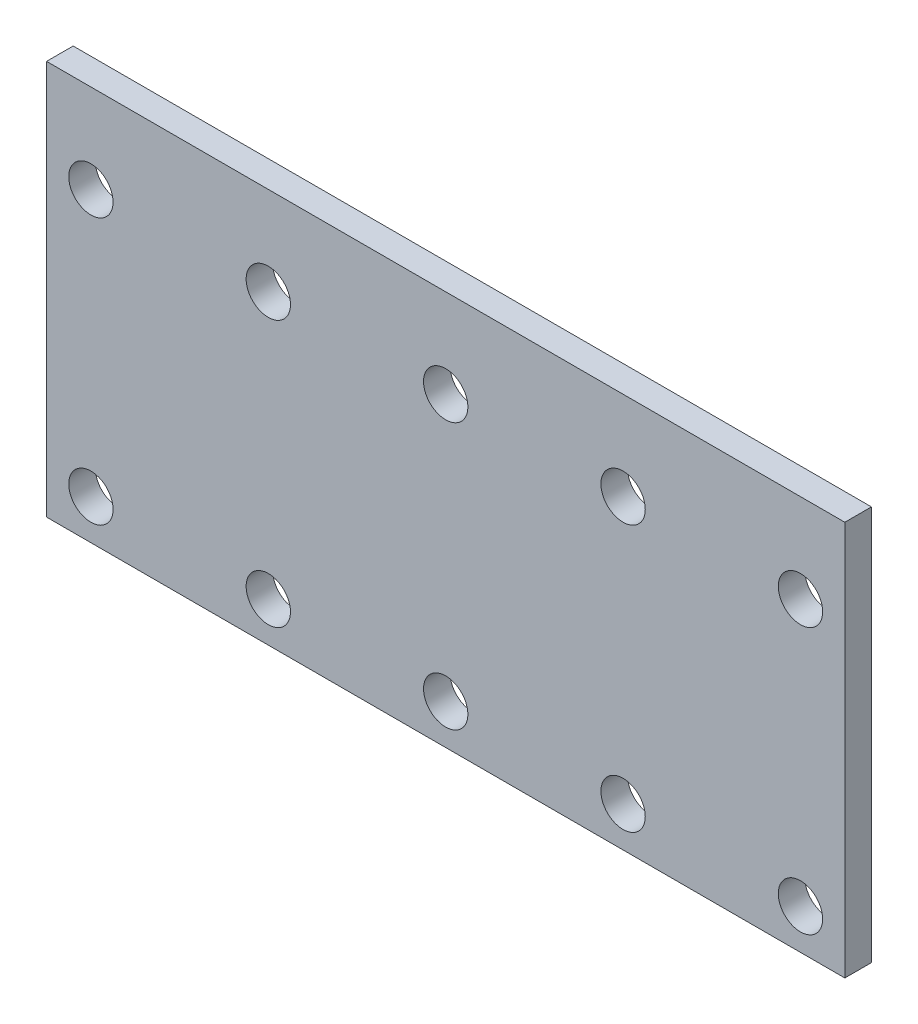
from build123d import *

# Parameters (mm, degrees)
SKETCH1_W           = 90
SKETCH1_H           = 14.5
SKETCH1_R           = 2.5
SKETCH1_H_2         = 30
BOSS_EXTRUDE1_DEPTH = 3


with BuildPart() as part:
    # Sketch1 → Boss-Extrude1 (new body)
    # profile 1 of 2: a face of its own
    with BuildSketch(Plane.XY):
        with Locations((45, 7.25)):
            Rectangle(SKETCH1_W, SKETCH1_H)
        with Locations((5, 4.5)):
            Circle(SKETCH1_R, mode=Mode.SUBTRACT)
        with Locations((25, 4.5)):
            Circle(SKETCH1_R, mode=Mode.SUBTRACT)
        with Locations((45, 4.5)):
            Circle(SKETCH1_R, mode=Mode.SUBTRACT)
        with Locations((65, 4.5)):
            Circle(SKETCH1_R, mode=Mode.SUBTRACT)
        with Locations((85, 4.5)):
            Circle(SKETCH1_R, mode=Mode.SUBTRACT)
    # profile 2 of 2: a face of its own
    with BuildSketch(Plane.XY):
        with Locations((45, 29.5)):
            Rectangle(SKETCH1_W, SKETCH1_H_2)
        with Locations((5, 34.5)):
            Circle(SKETCH1_R, mode=Mode.SUBTRACT)
        with Locations((25, 34.5)):
            Circle(SKETCH1_R, mode=Mode.SUBTRACT)
        with Locations((45, 34.5)):
            Circle(SKETCH1_R, mode=Mode.SUBTRACT)
        with Locations((65, 34.5)):
            Circle(SKETCH1_R, mode=Mode.SUBTRACT)
        with Locations((85, 34.5)):
            Circle(SKETCH1_R, mode=Mode.SUBTRACT)
    extrude(amount=BOSS_EXTRUDE1_DEPTH)


solid = part.part
